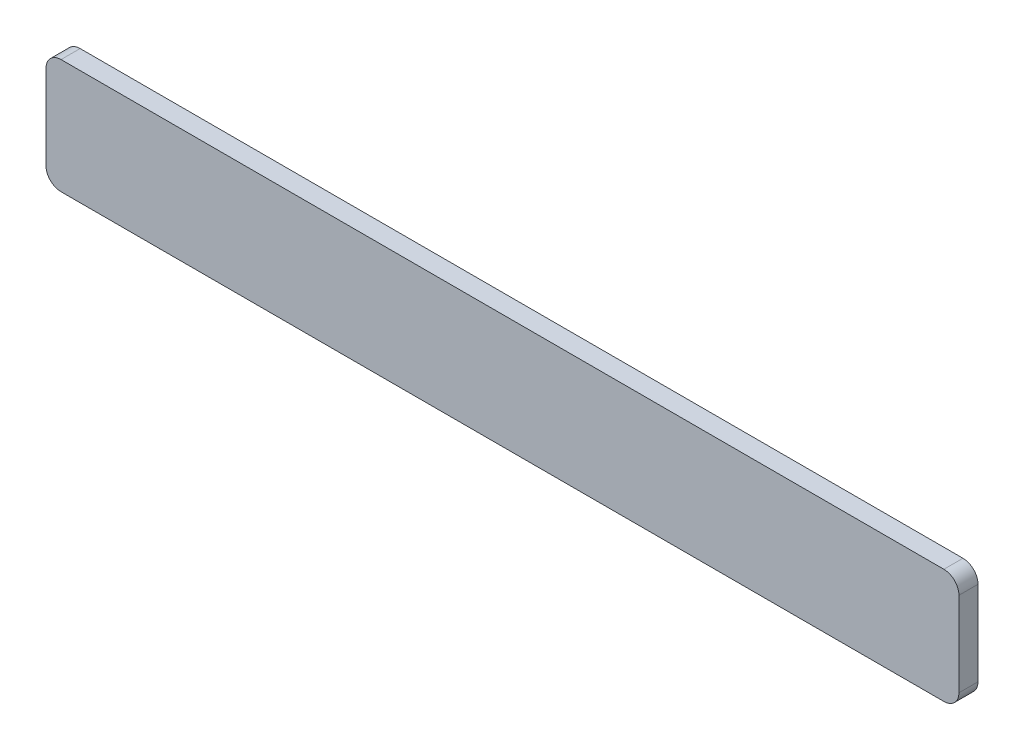
from build123d import *

# Parameters (mm, degrees)
SKETCH1_W           = 607.57
SKETCH1_H           = 76.2
BOSS_EXTRUDE1_DEPTH = 12.7
FILLET1_R           = 10


with BuildPart() as part:
    # Sketch1 → Boss-Extrude1 (new body)
    with BuildSketch(Plane.XY):
        with Locations((-303.785, 38.1)):
            Rectangle(SKETCH1_W, SKETCH1_H)
    extrude(amount=BOSS_EXTRUDE1_DEPTH)

    # Fillet1
    fillet1_edges = [part.edges().sort_by_distance(p)[0] for p in [
        (0, 0, 6.35),
        (-607.57, 0, 6.35),
        (-607.57, 76.2, 6.35),
        (0, 76.2, 6.35),
    ]]
    fillet(fillet1_edges, radius=FILLET1_R)


solid = part.part
